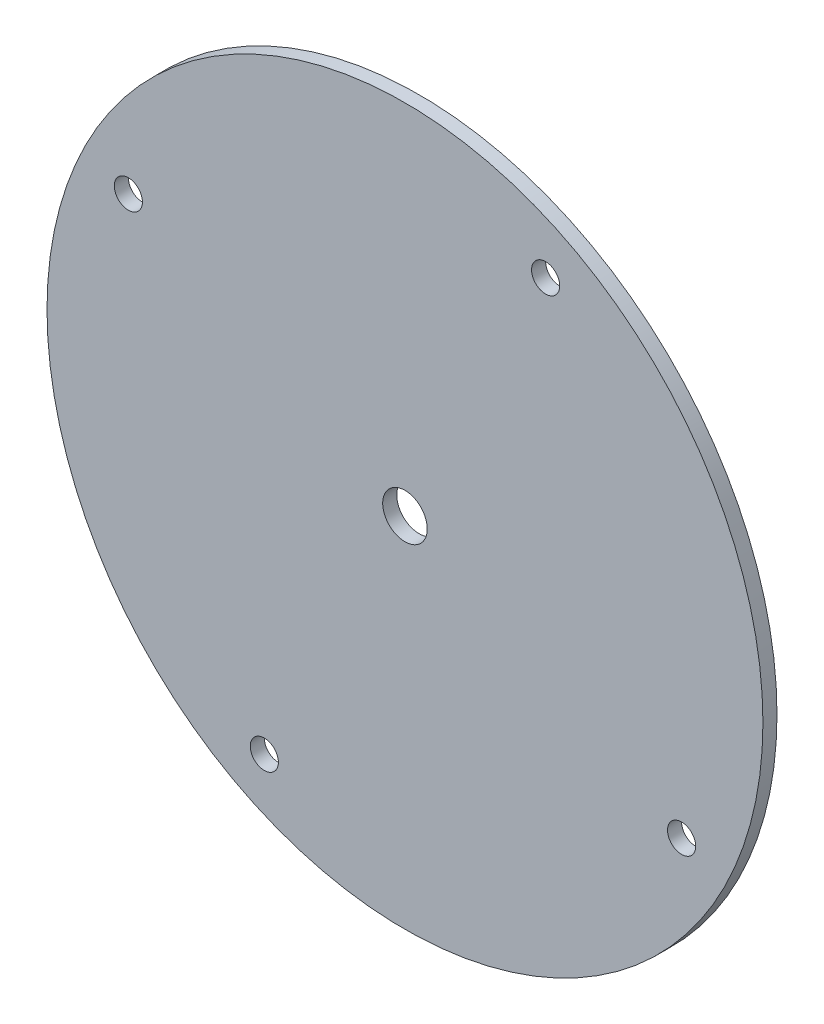
from build123d import *

# Parameters (mm, degrees)
SKETCH1_R           = 3
BOSS_EXTRUDE3_DEPTH = 3
SKETCH2_R           = 4.75
CUT_EXTRUDE1_DEPTH  = 109.016873682


with BuildPart() as part:
    # Sketch1 → Boss-Extrude3 (new body)
    # profile 1 of 5: a face of its own
    with BuildSketch(Plane.XY):
        with BuildLine():
            ThreePointArc((76.35, 0), (53.987602744, 53.987602744), (0, 76.35))
            ThreePointArc((0, 76.35), (-62.014972319, 44.536116897), (-72.348554199, -24.392810524))
            ThreePointArc((-72.348554199, -24.392810524), (-44.536116897, -62.014972319), (0, -76.35))
            ThreePointArc((0, -76.35), (53.987602744, -53.987602744), (76.35, 0))
        make_face()
        Polygon((-27.25, -54.236860279), (-24.5, -59), (-27.25, -63.763139721), (-32.75, -63.763139721), (-35.5, -59), (-32.75, -54.236860279), align=None, mode=Mode.SUBTRACT)
        Polygon((54.236860279, -27.25), (59, -24.5), (63.763139721, -27.25), (63.763139721, -32.75), (59, -35.5), (54.236860279, -32.75), align=None, mode=Mode.SUBTRACT)
        Polygon((-54.236860279, 27.25), (-59, 24.5), (-63.763139721, 27.25), (-63.763139721, 32.75), (-59, 35.5), (-54.236860279, 32.75), align=None, mode=Mode.SUBTRACT)
        Polygon((27.25, 54.236860279), (24.5, 59), (27.25, 63.763139721), (32.75, 63.763139721), (35.5, 59), (32.75, 54.236860279), align=None, mode=Mode.SUBTRACT)
    # profile 2 of 5: a face of its own
    with BuildSketch(Plane.XY):
        Polygon((-63.763139721, 32.75), (-63.763139721, 27.25), (-59, 24.5), (-54.236860279, 27.25), (-54.236860279, 32.75), (-59, 35.5), align=None)
        with Locations((-59, 30)):
            Circle(SKETCH1_R, mode=Mode.SUBTRACT)
    # profile 3 of 5: a face of its own
    with BuildSketch(Plane.XY):
        Polygon((32.75, 63.763139721), (27.25, 63.763139721), (24.5, 59), (27.25, 54.236860279), (32.75, 54.236860279), (35.5, 59), align=None)
        with Locations((30, 59)):
            Circle(SKETCH1_R, mode=Mode.SUBTRACT)
    # profile 4 of 5: a face of its own
    with BuildSketch(Plane.XY):
        Polygon((63.763139721, -32.75), (63.763139721, -27.25), (59, -24.5), (54.236860279, -27.25), (54.236860279, -32.75), (59, -35.5), align=None)
        with Locations((59, -30)):
            Circle(SKETCH1_R, mode=Mode.SUBTRACT)
    # profile 5 of 5: a face of its own
    with BuildSketch(Plane.XY):
        Polygon((-32.75, -63.763139721), (-27.25, -63.763139721), (-24.5, -59), (-27.25, -54.236860279), (-32.75, -54.236860279), (-35.5, -59), align=None)
        with Locations((-30, -59)):
            Circle(SKETCH1_R, mode=Mode.SUBTRACT)
    extrude(amount=BOSS_EXTRUDE3_DEPTH)

    # Sketch2 → Cut-Extrude1 (cut, through all)
    with BuildSketch(Plane.XY.offset(3)):
        Circle(SKETCH2_R)
    extrude(amount=-CUT_EXTRUDE1_DEPTH, mode=Mode.SUBTRACT)


solid = part.part
